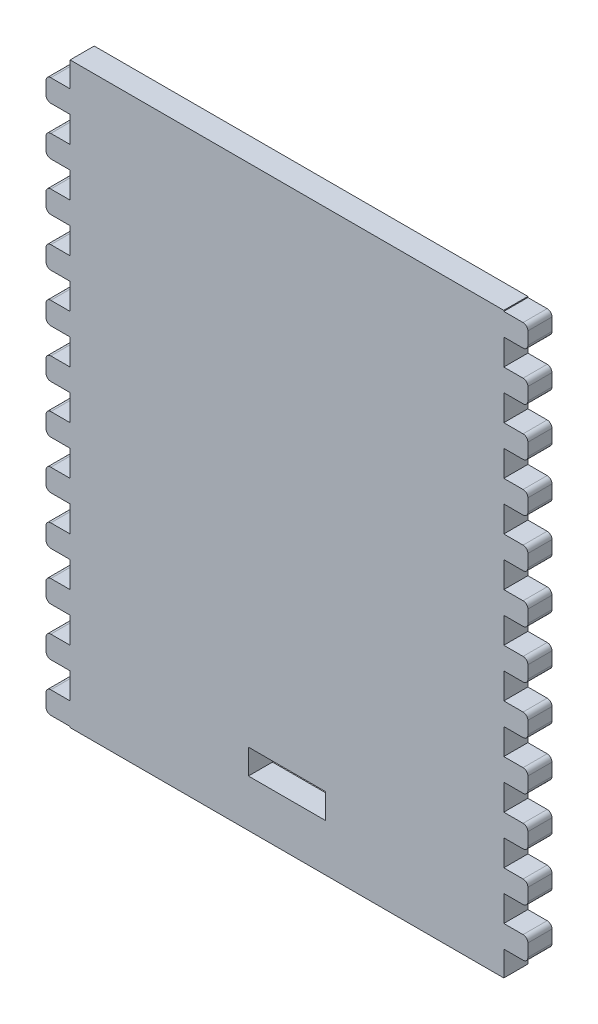
from build123d import *

# Parameters (mm, degrees)
SKETCH1_W           = 10.16
SKETCH1_H           = 3.302
BOSS_EXTRUDE1_DEPTH = 3.175
FILLET2_R           = 0.635


with BuildPart() as part:
    # Sketch1 → Boss-Extrude1 (new body)
    with BuildSketch(Plane.XY):
        Polygon((28.575, 38.1), (-28.575, 38.1), (-28.575, 34.798), (-31.75, 34.798), (-31.75, 31.877), (-28.575, 31.877), (-28.575, 28.448), (-31.75, 28.448), (-31.75, 25.527), (-28.575, 25.527), (-28.575, 22.098), (-31.75, 22.098), (-31.75, 19.177), (-28.575, 19.177), (-28.575, 15.748), (-31.75, 15.748), (-31.75, 12.827), (-28.575, 12.827), (-28.575, 9.398), (-31.75, 9.398), (-31.75, 6.477), (-28.575, 6.477), (-28.575, 3.048), (-31.75, 3.048), (-31.75, 0.127), (-28.575, 0.127), (-28.575, -3.302), (-31.75, -3.302), (-31.75, -6.223), (-28.575, -6.223), (-28.575, -9.652), (-31.75, -9.652), (-31.75, -12.573), (-28.575, -12.573), (-28.575, -16.002), (-31.75, -16.002), (-31.75, -18.923), (-28.575, -18.923), (-28.575, -22.352), (-31.75, -22.352), (-31.75, -25.273), (-28.575, -25.273), (-28.575, -28.702), (-31.75, -28.702), (-31.75, -31.623), (-28.575, -31.623), (-28.575, -35.052), (-31.75, -35.052), (-31.75, -37.973), (-28.575, -37.973), (-28.575, -38.1), (28.575, -38.1), (28.575, -34.798), (31.75, -34.798), (31.75, -31.877), (28.575, -31.877), (28.575, -28.448), (31.75, -28.448), (31.75, -25.527), (28.575, -25.527), (28.575, -22.098), (31.75, -22.098), (31.75, -19.177), (28.575, -19.177), (28.575, -15.748), (31.75, -15.748), (31.75, -12.827), (28.575, -12.827), (28.575, -9.398), (31.75, -9.398), (31.75, -6.477), (28.575, -6.477), (28.575, -3.048), (31.75, -3.048), (31.75, -0.127), (28.575, -0.127), (28.575, 3.302), (31.75, 3.302), (31.75, 6.223), (28.575, 6.223), (28.575, 9.652), (31.75, 9.652), (31.75, 12.573), (28.575, 12.573), (28.575, 16.002), (31.75, 16.002), (31.75, 18.923), (28.575, 18.923), (28.575, 22.352), (31.75, 22.352), (31.75, 25.273), (28.575, 25.273), (28.575, 28.702), (31.75, 28.702), (31.75, 31.623), (28.575, 31.623), (28.575, 35.052), (31.75, 35.052), (31.75, 37.973), (28.575, 37.973), align=None)
        with Locations((0, -30.226)):
            Rectangle(SKETCH1_W, SKETCH1_H, mode=Mode.SUBTRACT)
    extrude(amount=BOSS_EXTRUDE1_DEPTH)

    # Fillet2
    fillet2_edges = [part.edges().sort_by_distance(p)[0] for p in [
        (31.75, -34.798, 1.5875),
        (31.75, -28.448, 1.5875),
        (31.75, -22.098, 1.5875),
        (31.75, -15.748, 1.5875),
        (31.75, -9.398, 1.5875),
        (31.75, -3.048, 1.5875),
        (31.75, 3.302, 1.5875),
        (31.75, 9.652, 1.5875),
        (31.75, 16.002, 1.5875),
        (31.75, 22.352, 1.5875),
        (31.75, 28.702, 1.5875),
        (31.75, 35.052, 1.5875),
        (31.75, 37.973, 1.5875),
        (31.75, 31.623, 1.5875),
        (31.75, 25.273, 1.5875),
        (31.75, 18.923, 1.5875),
        (31.75, 12.573, 1.5875),
        (31.75, 6.223, 1.5875),
        (31.75, -0.127, 1.5875),
        (31.75, -6.477, 1.5875),
        (31.75, -12.827, 1.5875),
        (31.75, -19.177, 1.5875),
        (31.75, -25.527, 1.5875),
        (31.75, -31.877, 1.5875),
        (-31.75, -35.052, 1.5875),
        (-31.75, -28.702, 1.5875),
        (-31.75, -22.352, 1.5875),
        (-31.75, -16.002, 1.5875),
        (-31.75, -9.652, 1.5875),
        (-31.75, -3.302, 1.5875),
        (-31.75, 3.048, 1.5875),
        (-31.75, 9.398, 1.5875),
        (-31.75, 15.748, 1.5875),
        (-31.75, 22.098, 1.5875),
        (-31.75, 28.448, 1.5875),
        (-31.75, 34.798, 1.5875),
        (-31.75, -37.973, 1.5875),
        (-31.75, -31.623, 1.5875),
        (-31.75, -25.273, 1.5875),
        (-31.75, -18.923, 1.5875),
        (-31.75, -12.573, 1.5875),
        (-31.75, -6.223, 1.5875),
        (-31.75, 0.127, 1.5875),
        (-31.75, 6.477, 1.5875),
        (-31.75, 12.827, 1.5875),
        (-31.75, 19.177, 1.5875),
        (-31.75, 25.527, 1.5875),
        (-31.75, 31.877, 1.5875),
    ]]
    fillet(fillet2_edges, radius=FILLET2_R)


solid = part.part
